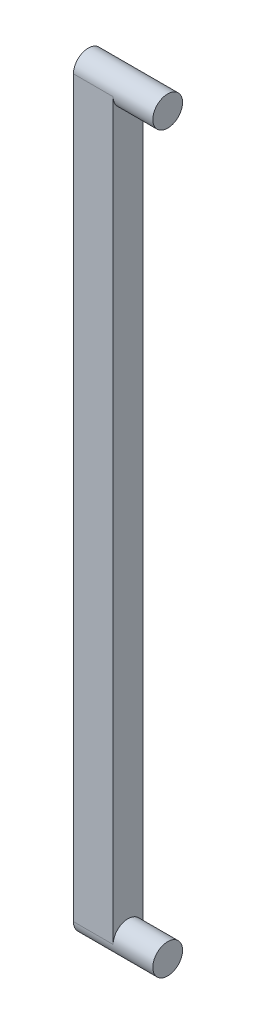
from build123d import *

# Parameters (mm, degrees)
BOSS_EXTRUDE1_DEPTH = 2
SKETCH1_3_R         = 0.75
BOSS_EXTRUDE2_DEPTH = 4


with BuildPart() as part:
    # Sketch1 → Boss-Extrude1 (new body)
    with BuildSketch(Plane.YZ):
        with BuildLine():
            Line((37, 1.5), (0, 1.5))
            ThreePointArc((0, 1.5), (-0.75, 0.75), (0, 0))
            Line((0, 0), (37, 0))
            ThreePointArc((37, 0), (37.75, 0.75), (37, 1.5))
        make_face()
    extrude(amount=BOSS_EXTRUDE1_DEPTH)

    # Sketch1<3> → Boss-Extrude2 (add)
    with BuildSketch(Plane.YZ):
        with Locations((0, 0.75)):
            Circle(SKETCH1_3_R)
        with Locations((37, 0.75)):
            Circle(SKETCH1_3_R)
    extrude(amount=BOSS_EXTRUDE2_DEPTH)


solid = part.part
